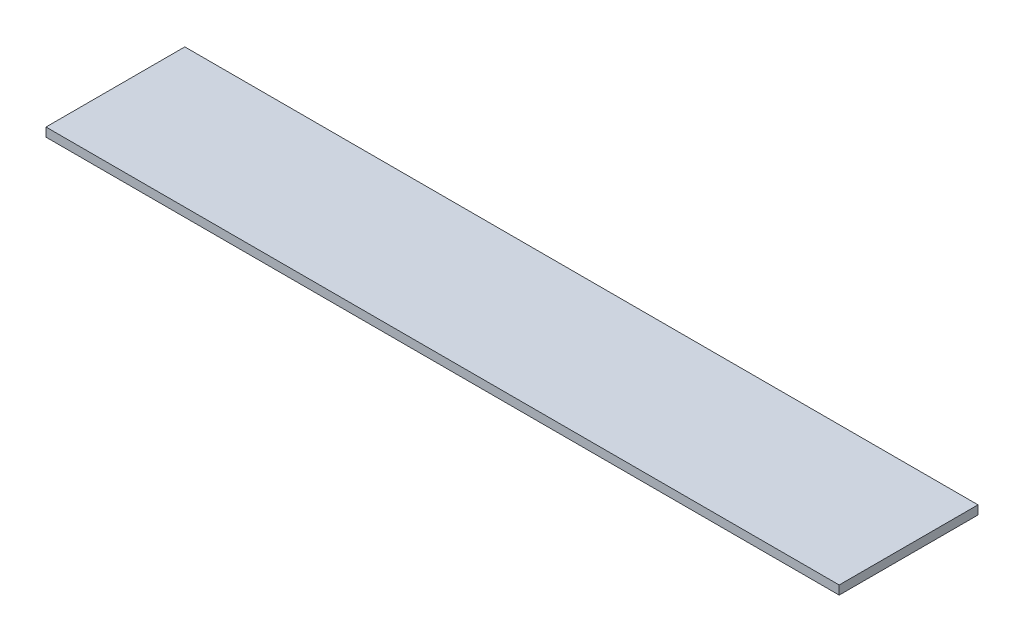
from build123d import *

# Parameters (mm, degrees)
SKETCH1_W           = 381
SKETCH1_H           = 381
BOSS_EXTRUDE1_DEPTH = 25.4
FILLET1_R           = 25.4
BOSS_EXTRUDE2_START = 127
BOSS_EXTRUDE2_DEPTH = 127
FILLET5_R           = 2.54
FILLET6_R           = 2.54
SKETCH3_W           = 381
SKETCH3_H           = 45.536829563
BOSS_EXTRUDE3_DEPTH = 127
CUT_EXTRUDE1_START  = -127
CUT_EXTRUDE1_DEPTH  = 127
CUT_EXTRUDE2_START  = -127
CUT_EXTRUDE2_DEPTH  = 127
SKETCH7_W           = 159.592910526
SKETCH7_H           = 279.668363548
CUT_EXTRUDE3_DEPTH  = 540.805557869
CUT_EXTRUDE4_DEPTH  = 121.92
SKETCH10_W          = 12.830407975
SKETCH10_H          = 5.381034355
SKETCH10_W_2        = 12.189915085
SKETCH10_H_2        = 7.553204363
BOSS_EXTRUDE4_DEPTH = 5.08
SKETCH12_W          = 381
SKETCH12_H          = 5.08
BOSS_EXTRUDE5_DEPTH = 5.842
SKETCH14_W          = 25.4
SKETCH14_H          = 25.4
BOSS_EXTRUDE6_DEPTH = 5.08
SKETCH15_W          = 381
SKETCH15_H          = 25.4
BOSS_EXTRUDE7_DEPTH = 2.54
SKETCH18_W          = 25.978829563
SKETCH18_H          = 5.08
CUT_EXTRUDE6_DEPTH  = 463.44511455
SKETCH19_W          = 25.4
SKETCH19_H          = 2.54
CUT_EXTRUDE7_DEPTH  = 463.44511455
SKETCH21_W          = 76.2
SKETCH21_H          = 25.4
BOSS_EXTRUDE8_DEPTH = 5.08
SKETCH22_W          = 457.2
SKETCH22_H          = 5.08
BOSS_EXTRUDE9_DEPTH = 54.61


with BuildPart() as part:
    # Sketch1 → Boss-Extrude1 (new body)
    with BuildSketch(Plane(origin=(0, 0, 0), x_dir=(1, 0, 0), z_dir=(0, 1, 0))):
        with Locations((-70.583665339, -17.076693227)):
            Rectangle(SKETCH1_W, SKETCH1_H)
    extrude(amount=BOSS_EXTRUDE1_DEPTH)

    # Fillet1
    fillet1_edges = [part.edges().sort_by_distance(p)[0] for p in [
        (-261.083665339, 12.7, -173.423306773),
        (119.916334661, 12.7, -173.423306773),
        (119.916334661, 12.7, 207.576693227),
        (-261.083665339, 12.7, 207.576693227),
    ]]
    fillet(fillet1_edges, radius=FILLET1_R)

    # Sketch2 → Boss-Extrude2 (add)
    with BuildSketch(Plane(origin=(0, 25.4, 0), x_dir=(1, 0, 0), z_dir=(0, 1, 0)).offset(BOSS_EXTRUDE2_START)):
        with BuildLine():
            ThreePointArc((94.516334661, -207.576693227), (112.476846903, -200.137205469), (119.916334661, -182.176693227))
            Line((119.916334661, -182.176693227), (119.916334661, -162.77058906))
            ThreePointArc((119.916334661, -162.77058906), (115.157902312, -162.131654008), (110.356896004, -162.096230085))
            Line((110.356896004, -162.096230085), (110.356896004, -169.819933243))
            ThreePointArc((110.356896004, -169.819933243), (110.63661406, -173.531591416), (110.356896004, -177.243249589))
            ThreePointArc((110.356896004, -177.243249589), (103.383001842, -191.043360408), (89.582891024, -198.017254569))
            ThreePointArc((89.582891024, -198.017254569), (85.871232851, -198.296972625), (82.159574678, -198.017254569))
            Line((82.159574678, -198.017254569), (74.435871519, -198.017254569))
            ThreePointArc((74.435871519, -198.017254569), (74.471295442, -202.818260878), (75.110230494, -207.576693227))
            Line((75.110230494, -207.576693227), (94.516334661, -207.576693227))
        make_face()
        with BuildLine():
            ThreePointArc((110.356896004, 127.942843631), (115.157902312, 127.978267553), (119.916334661, 128.617202605))
            Line((119.916334661, 128.617202605), (119.916334661, 148.023306773))
            ThreePointArc((119.916334661, 148.023306773), (112.476846903, 165.983819015), (94.516334661, 173.423306773))
            Line((94.516334661, 173.423306773), (75.110230494, 173.423306773))
            ThreePointArc((75.110230494, 173.423306773), (74.471295442, 168.664874423), (74.435871519, 163.863868115))
            Line((74.435871519, 163.863868115), (82.159574678, 163.863868115))
            ThreePointArc((82.159574678, 163.863868115), (85.871232851, 164.143586171), (89.582891024, 163.863868115))
            ThreePointArc((89.582891024, 163.863868115), (103.383001842, 156.889973954), (110.356896004, 143.089863135))
            ThreePointArc((110.356896004, 143.089863135), (110.63661406, 139.378204962), (110.356896004, 135.666546789))
            Line((110.356896004, 135.666546789), (110.356896004, 127.942843631))
        make_face()
        with BuildLine():
            Line((-235.683665339, -207.576693227), (-216.277561171, -207.576693227))
            ThreePointArc((-216.277561171, -207.576693227), (-215.638626119, -202.818260878), (-215.603202197, -198.017254569))
            Line((-215.603202197, -198.017254569), (-223.326905355, -198.017254569))
            ThreePointArc((-223.326905355, -198.017254569), (-227.038563528, -198.296972625), (-230.750221701, -198.017254569))
            ThreePointArc((-230.750221701, -198.017254569), (-244.55033252, -191.043360408), (-251.524226681, -177.243249589))
            ThreePointArc((-251.524226681, -177.243249589), (-251.803944737, -173.531591416), (-251.524226681, -169.819933243))
            Line((-251.524226681, -169.819933243), (-251.524226681, -162.096230085))
            ThreePointArc((-251.524226681, -162.096230085), (-256.325232989, -162.131654008), (-261.083665339, -162.77058906))
            Line((-261.083665339, -162.77058906), (-261.083665339, -182.176693227))
            ThreePointArc((-261.083665339, -182.176693227), (-253.644177581, -200.137205469), (-235.683665339, -207.576693227))
        make_face()
        with BuildLine():
            ThreePointArc((-215.603202197, 163.863868115), (-215.638626119, 168.664874423), (-216.277561171, 173.423306773))
            Line((-216.277561171, 173.423306773), (-235.683665339, 173.423306773))
            ThreePointArc((-235.683665339, 173.423306773), (-253.644177581, 165.983819015), (-261.083665339, 148.023306773))
            Line((-261.083665339, 148.023306773), (-261.083665339, 128.617202605))
            ThreePointArc((-261.083665339, 128.617202605), (-256.325232989, 127.978267553), (-251.524226681, 127.942843631))
            Line((-251.524226681, 127.942843631), (-251.524226681, 135.666546789))
            ThreePointArc((-251.524226681, 135.666546789), (-251.803944737, 139.378204962), (-251.524226681, 143.089863135))
            ThreePointArc((-251.524226681, 143.089863135), (-244.55033252, 156.889973954), (-230.750221701, 163.863868115))
            ThreePointArc((-230.750221701, 163.863868115), (-227.038563528, 164.143586171), (-223.326905355, 163.863868115))
            Line((-223.326905355, 163.863868115), (-215.603202197, 163.863868115))
        make_face()
    extrude(amount=-BOSS_EXTRUDE2_DEPTH)

    # Fillet5
    fillet5_edges = [part.edges().sort_by_distance(p)[0] for p in [
        (74.435871519, 88.9, -163.863868115),
        (110.356896004, 88.9, -127.942843631),
        (119.916334661, 88.9, -128.617202605),
        (75.110230494, 88.9, -173.423306773),
    ]]
    fillet(fillet5_edges, radius=FILLET5_R)

    # Fillet6
    fillet6_edges = [part.edges().sort_by_distance(p)[0] for p in [
        (-215.603202197, 88.9, -163.863868115),
        (-216.277561171, 88.9, -173.423306773),
        (-261.083665339, 88.9, -128.617202605),
        (-251.524226681, 88.9, -127.942843631),
        (74.435871519, 88.9, 198.017254569),
        (75.110230494, 88.9, 207.576693227),
        (119.916334661, 88.9, 162.77058906),
        (110.356896004, 88.9, 162.096230085),
        (-216.277561171, 88.9, 207.576693227),
        (-215.603202197, 88.9, 198.017254569),
        (-251.524226681, 88.9, 162.096230085),
        (-261.083665339, 88.9, 162.77058906),
    ]]
    fillet(fillet6_edges, radius=FILLET6_R)

    # Sketch3 → Boss-Extrude3 (add)
    with BuildSketch(Plane(origin=(0, 152.4, 0), x_dir=(1, 0, 0), z_dir=(0, 1, 0))):
        with Locations((-70.583665339, -184.808278446)):
            Rectangle(SKETCH3_W, SKETCH3_H)
    extrude(amount=BOSS_EXTRUDE3_DEPTH)

    # Sketch5 → Cut-Extrude1 (cut)
    with BuildSketch(Plane.XZ.offset(-152.4).offset(CUT_EXTRUDE1_START)):
        with BuildLine():
            Line((-261.083665339, 162.039863664), (-261.083665339, 164.916350572))
            ThreePointArc((-261.083665339, 164.916350572), (-260.459455915, 163.248613642), (-258.89362875, 162.400575222))
            ThreePointArc((-258.89362875, 162.400575222), (-256.499630965, 162.144358959), (-254.094230188, 162.039863664))
            Line((-254.094230188, 162.039863664), (-261.083665339, 162.039863664))
        make_face()
        with BuildLine():
            Line((-261.083665339, 207.576693227), (-235.683665339, 207.576693227))
            ThreePointArc((-235.683665339, 207.576693227), (-253.644177581, 200.137205469), (-261.083665339, 182.176693227))
            Line((-261.083665339, 182.176693227), (-261.083665339, 207.576693227))
        make_face()
    extrude(amount=CUT_EXTRUDE1_DEPTH, mode=Mode.SUBTRACT)

    # Sketch6 → Cut-Extrude2 (cut)
    with BuildSketch(Plane.XZ.offset(-152.4).offset(CUT_EXTRUDE2_START)):
        with BuildLine():
            Line((119.916334661, 162.039863664), (112.926899511, 162.039863664))
            ThreePointArc((112.926899511, 162.039863664), (115.332300288, 162.144358959), (117.726298073, 162.400575222))
            ThreePointArc((117.726298073, 162.400575222), (119.292125238, 163.248613642), (119.916334661, 164.916350572))
            Line((119.916334661, 164.916350572), (119.916334661, 162.039863664))
        make_face()
        with BuildLine():
            Line((119.916334661, 207.576693227), (119.916334661, 182.176693227))
            ThreePointArc((119.916334661, 182.176693227), (112.476846903, 200.137205469), (94.516334661, 207.576693227))
            Line((94.516334661, 207.576693227), (119.916334661, 207.576693227))
        make_face()
    extrude(amount=CUT_EXTRUDE2_DEPTH, mode=Mode.SUBTRACT)

    # Sketch7 → Cut-Extrude3 (cut, through all)
    with BuildSketch(Plane.XY.offset(207.576693227)):
        with Locations((-277.192611624, 12.565818226)):
            Rectangle(SKETCH7_W, SKETCH7_H)
        Polygon((188.205407311, 152.4), (-197.396156361, 152.4), (-197.396156361, -127.268363548), (-197.396156361, -138.930106511), (188.205407311, -138.930106511), align=None)
    extrude(amount=-CUT_EXTRUDE3_DEPTH, mode=Mode.SUBTRACT)

    # Sketch9 → Cut-Extrude4 (cut)
    with BuildSketch(Plane(origin=(0, 279.4, 0), x_dir=(1, 0, 0), z_dir=(0, 1, 0))):
        with BuildLine():
            Line((112.926899511, -162.039863664), (-254.094230188, -162.039863664))
            ThreePointArc((-254.094230188, -162.039863664), (-256.499630965, -162.144358959), (-258.89362875, -162.400575222))
            ThreePointArc((-258.89362875, -162.400575222), (-260.459455915, -163.248613642), (-261.083665339, -164.916350572))
            Line((-261.083665339, -164.916350572), (-261.083665339, -182.176693227))
            ThreePointArc((-261.083665339, -182.176693227), (-253.644177581, -200.137205469), (-235.683665339, -207.576693227))
            Line((-235.683665339, -207.576693227), (94.516334661, -207.576693227))
            ThreePointArc((94.516334661, -207.576693227), (112.476846903, -200.137205469), (119.916334661, -182.176693227))
            Line((119.916334661, -182.176693227), (119.916334661, -164.916350572))
            ThreePointArc((119.916334661, -164.916350572), (119.292125238, -163.248613642), (117.726298073, -162.400575222))
            ThreePointArc((117.726298073, -162.400575222), (115.332300288, -162.144358959), (112.926899511, -162.039863664))
        make_face()
    extrude(amount=-CUT_EXTRUDE4_DEPTH, mode=Mode.SUBTRACT)

    # Sketch10 → Boss-Extrude4 (add)
    with BuildSketch(Plane(origin=(0, 157.48, 0), x_dir=(1, 0, 0), z_dir=(0, 1, 0))):
        with Locations((-254.668461352, -164.730380842)):
            Rectangle(SKETCH10_W, SKETCH10_H)
        with Locations((113.821377119, -165.816465846)):
            Rectangle(SKETCH10_W_2, SKETCH10_H_2)
    extrude(amount=-BOSS_EXTRUDE4_DEPTH)

    # Sketch12 → Boss-Extrude5 (add)
    with BuildSketch(Plane(origin=(0, 0, 162.039863664), x_dir=(-1, 0, 0), z_dir=(0, 0, -1))):
        with Locations((70.583665339, 154.94)):
            Rectangle(SKETCH12_W, SKETCH12_H)
    extrude(amount=BOSS_EXTRUDE5_DEPTH)

    # Sketch14 → Boss-Extrude6 (add)
    with BuildSketch(Plane(origin=(0, 157.48, 0), x_dir=(1, 0, 0), z_dir=(0, 1, 0))):
        with Locations((107.216334661, -194.876693227)):
            Rectangle(SKETCH14_W, SKETCH14_H)
        with Locations((-248.383665339, -194.876693227)):
            Rectangle(SKETCH14_W, SKETCH14_H)
    extrude(amount=-BOSS_EXTRUDE6_DEPTH)

    # Sketch15 → Boss-Extrude7 (add)
    with BuildSketch(Plane(origin=(0, 157.48, 0), x_dir=(1, 0, 0), z_dir=(0, 1, 0))):
        with Locations((-70.583665339, -194.876693227)):
            Rectangle(SKETCH15_W, SKETCH15_H)
    extrude(amount=BOSS_EXTRUDE7_DEPTH)

    # Sketch18 → Cut-Extrude6 (cut, through all)
    with BuildSketch(Plane.ZY.offset(261.083665339)):
        with Locations((169.187278445, 154.94)):
            Rectangle(SKETCH18_W, SKETCH18_H)
    extrude(amount=-CUT_EXTRUDE6_DEPTH, mode=Mode.SUBTRACT)

    # Sketch19 → Cut-Extrude7 (cut, through all)
    with BuildSketch(Plane.ZY.offset(261.083665339)):
        with Locations((194.876693227, 153.67)):
            Rectangle(SKETCH19_W, SKETCH19_H)
    extrude(amount=-CUT_EXTRUDE7_DEPTH, mode=Mode.SUBTRACT)

    # Sketch21 → Boss-Extrude8 (add)
    with BuildSketch(Plane(origin=(0, 160.02, 0), x_dir=(1, 0, 0), z_dir=(0, 1, 0))):
        with Locations((-299.183665339, -194.876693227)):
            Rectangle(SKETCH21_W, SKETCH21_H)
    extrude(amount=-BOSS_EXTRUDE8_DEPTH)

    # Sketch22 → Boss-Extrude9 (add)
    with BuildSketch(Plane(origin=(0, 0, 182.176693227), x_dir=(-1, 0, 0), z_dir=(0, 0, -1))):
        with Locations((108.683665339, 157.48)):
            Rectangle(SKETCH22_W, SKETCH22_H)
    extrude(amount=BOSS_EXTRUDE9_DEPTH)


solid = part.part
